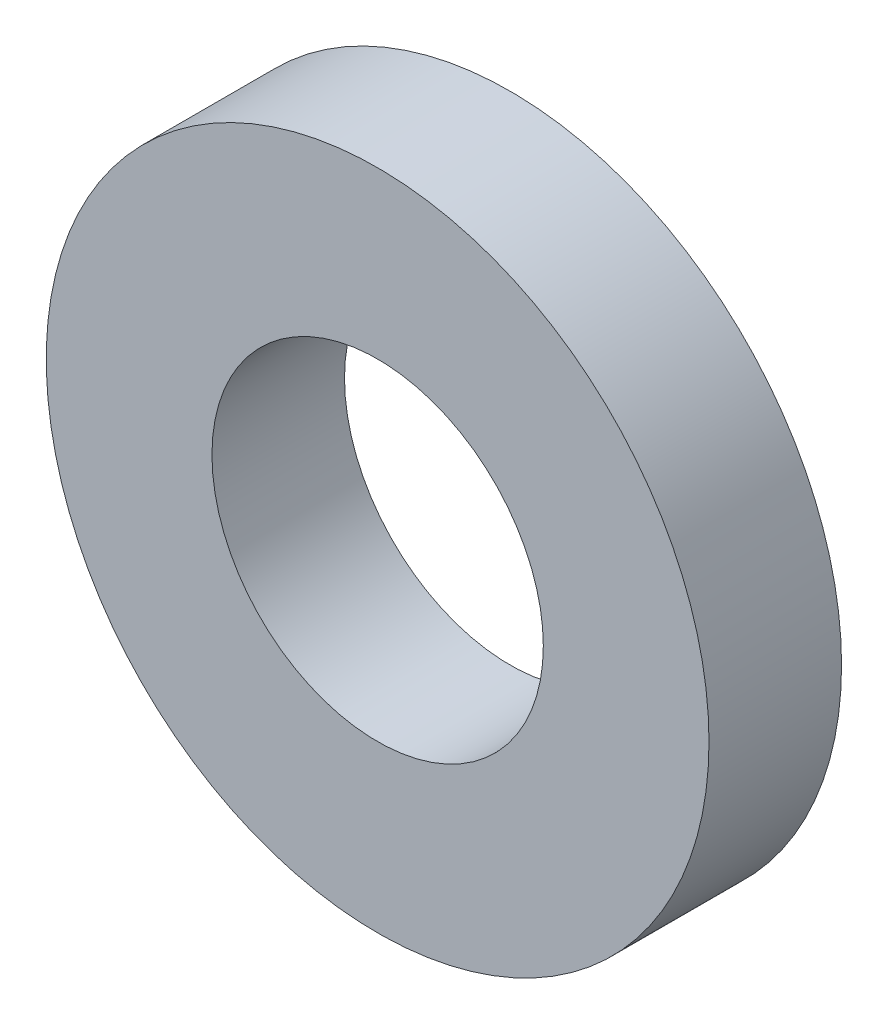
from build123d import *

# Parameters (mm, degrees)
SKETCH1_R           = 10
SKETCH1_R_2         = 5
BOSS_EXTRUDE1_DEPTH = 4


with BuildPart() as part:
    # Sketch1 → Boss-Extrude1 (new body)
    with BuildSketch(Plane.XY):
        Circle(SKETCH1_R)
        Circle(SKETCH1_R_2, mode=Mode.SUBTRACT)
    extrude(amount=BOSS_EXTRUDE1_DEPTH)


solid = part.part
